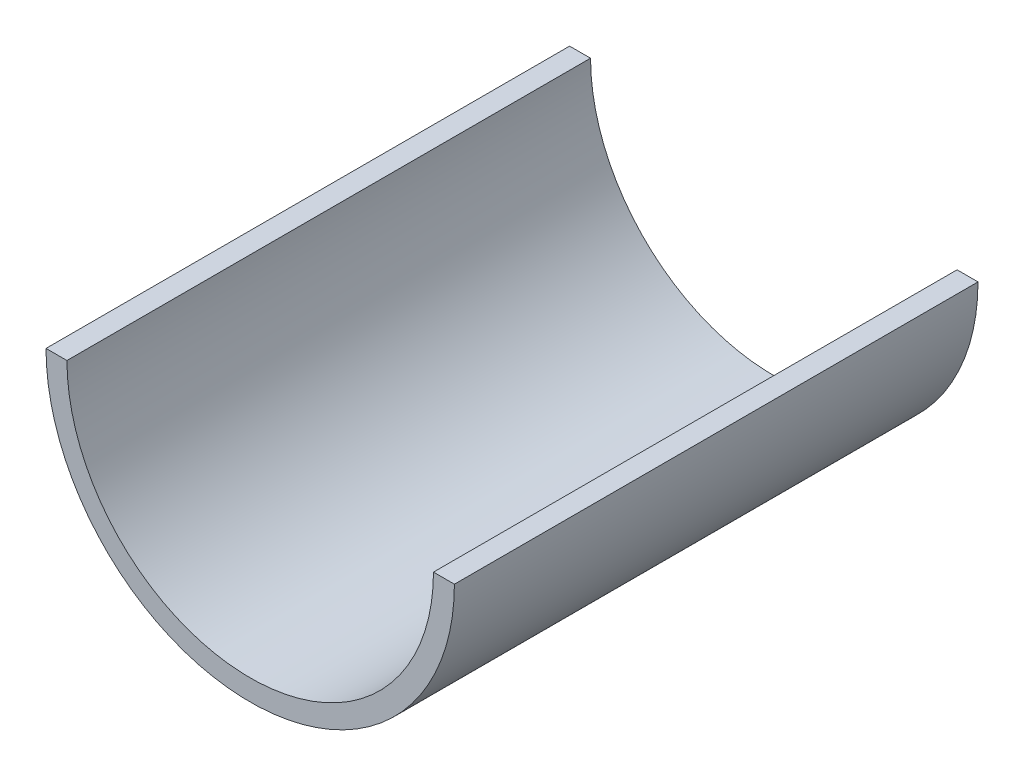
from build123d import *

# Parameters (mm, degrees)
EXTRUDE_THIN1_DEPTH = 100


with BuildPart() as part:
    # Sketch1 → Extrude-Thin1 (new body)
    with BuildSketch(Plane.XY):
        with BuildLine():
            ThreePointArc((-35, 0), (0, -35), (35, 0))
            Line((35, 0), (39, 0))
            ThreePointArc((39, 0), (0, -39), (-39, 0))
            Line((-39, 0), (-35, 0))
        make_face()
    extrude(amount=EXTRUDE_THIN1_DEPTH)


solid = part.part
